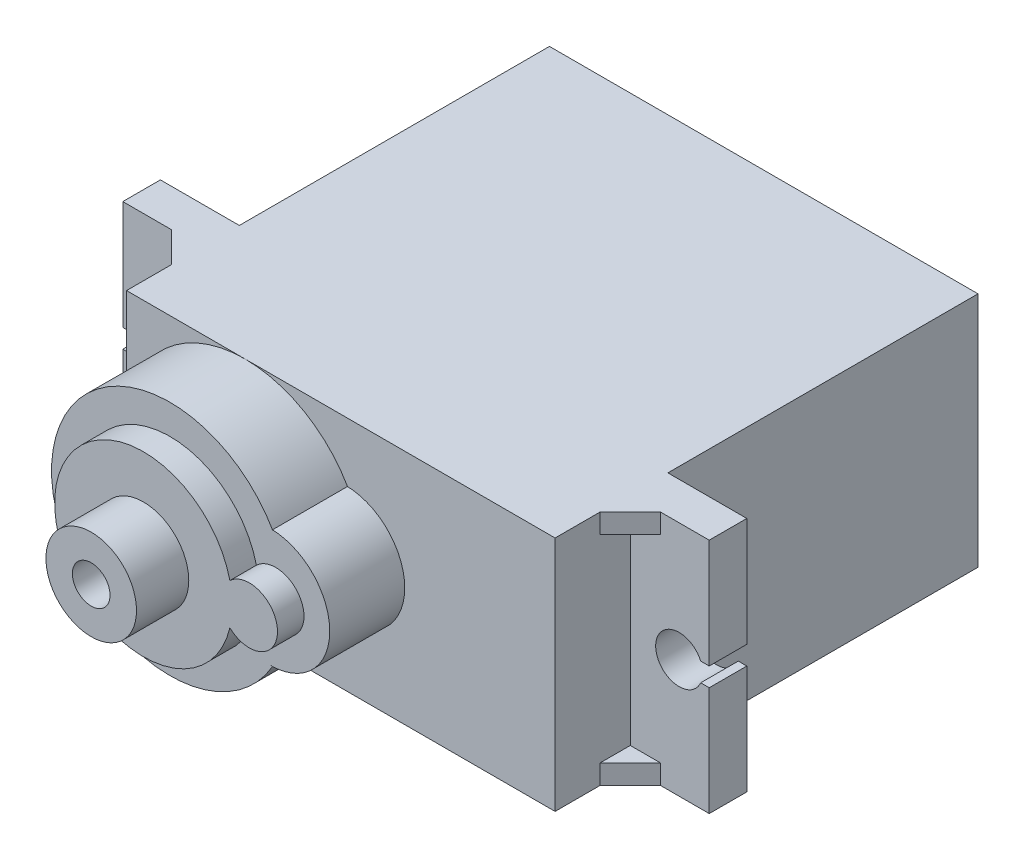
from build123d import *

# Parameters (mm, degrees)
ESQUISSE1_W              = 22.8
ESQUISSE1_H              = 12.6
BOSS_EXTRU_1_DEPTH       = 22.5
ESQUISSE2_W              = 31.2
ESQUISSE2_H              = 12.6
BOSS_EXTRU_2_DEPTH       = 2
ENL_V_MAT_EXTRU_1_DEPTH  = 36.0714984
BOSS_EXTRU_3_DEPTH       = 3.99
BOSS_EXTRUDE6_DEPTH      = 1.41
BOSS_EXTRUDE6_DEPTH_BACK = 4
SKETCH1_R                = 4.725
SKETCH1_R_2              = 1.5
SKETCH3_R                = 2.41
BOSS_EXTRUDE7_DEPTH      = 2.78
SKETCH4_R                = 1
CUT_EXTRUDE1_DEPTH       = 9.78
SKETCH8_W                = 1.6
SKETCH8_H                = 1.04
BOSS_EXTRUDE9_DEPTH      = 1.6
CUT_EXTRUDE3_DEPTH       = 43.472296853
MIRROR3_COPY_1_SKETCH_W  = 22.8
MIRROR3_COPY_1_SKETCH_H  = 12.6
MIRROR3_COPY_1_DEPTH     = 22.5
MIRROR3_COPY_2_SKETCH_W  = 1.6
MIRROR3_COPY_2_SKETCH_H  = 1.04
MIRROR3_COPY_2_DEPTH     = 1.6
MIRROR3_COPY_3_DEPTH     = 43.472296853


with BuildPart() as part:
    # Esquisse1 → Boss.-Extru.1 (new body)
    with BuildSketch(Plane.XY):
        with Locations((-11.4, 6.3)):
            Rectangle(ESQUISSE1_W, ESQUISSE1_H)
    boss_extru_1 = extrude(amount=BOSS_EXTRU_1_DEPTH)

    # Esquisse2 → Boss.-Extru.2 (add)
    with BuildSketch(Plane.XY.offset(18.5)):
        with Locations((-11.4, 6.3)):
            Rectangle(ESQUISSE2_W, ESQUISSE2_H)
    extrude(amount=-BOSS_EXTRU_2_DEPTH)

    # Esquisse3 → Enlèv. mat.-Extru.1 (cut, through all)
    with BuildSketch(Plane.XY.offset(18.5)):
        with BuildLine():
            Line((3.745643924, 6.8), (4.2, 6.8))
            Line((4.2, 6.8), (4.2, 5.8))
            Line((4.2, 5.8), (3.745643924, 5.8))
            ThreePointArc((3.745643924, 5.8), (1.35, 6.3), (3.745643924, 6.8))
        make_face()
        with BuildLine():
            Line((-26.545643924, 5.8), (-27, 5.8))
            Line((-27, 5.8), (-27, 6.8))
            Line((-27, 6.8), (-26.545643924, 6.8))
            ThreePointArc((-26.545643924, 6.8), (-24.15, 6.3), (-26.545643924, 5.8))
        make_face()
    extrude(amount=-ENL_V_MAT_EXTRU_1_DEPTH, mode=Mode.SUBTRACT)

    # Esquisse4 → Boss.-Extru.3 (add)
    with BuildSketch(Plane.XY.offset(22.5)):
        with BuildLine():
            Line((-11.15, 9.45), (-11.044039956, 9.45))
            ThreePointArc((-11.044039956, 9.45), (-22.8, 6.3), (-11.044039956, 3.15))
            Line((-11.044039956, 3.15), (-11.15, 3.15))
            ThreePointArc((-11.15, 3.15), (-8, 6.3), (-11.15, 9.45))
        make_face()
    extrude(amount=BOSS_EXTRU_3_DEPTH)

    # Sketch1 → Boss-Extrude6 (add, two sides: drawn at the far end of the back side and taken through both)
    with BuildSketch(Plane.XY.offset(26.49).offset(-BOSS_EXTRUDE6_DEPTH_BACK)):
        with Locations((-16.5, 6.3)):
            Circle(SKETCH1_R)
        with Locations((-10.87, 6.3)):
            Circle(SKETCH1_R_2)
    extrude(amount=BOSS_EXTRUDE6_DEPTH + BOSS_EXTRUDE6_DEPTH_BACK)

    # Sketch3 → Boss-Extrude7 (add)
    with BuildSketch(Plane.XY.offset(27.9)):
        with Locations((-16.5, 6.3)):
            Circle(SKETCH3_R)
    extrude(amount=BOSS_EXTRUDE7_DEPTH)

    # Sketch4 → Cut-Extrude1 (cut)
    with BuildSketch(Plane.XY.offset(30.68)):
        with Locations((-16.5, 6.3)):
            Circle(SKETCH4_R)
    extrude(amount=-CUT_EXTRUDE1_DEPTH, mode=Mode.SUBTRACT)

    # Sketch8 → Boss-Extrude9 (add)
    with BuildSketch(Plane.XY.offset(18.5)):
        with Locations((0.8, 0.52)):
            Rectangle(SKETCH8_W, SKETCH8_H)
    boss_extrude9 = extrude(amount=BOSS_EXTRUDE9_DEPTH)

    # Sketch9 → Cut-Extrude3 (cut, through all)
    with BuildSketch(Plane(origin=(0, 1.04, 0), x_dir=(1, 0, 0), z_dir=(0, 1, 0))):
        Polygon((1.6, -18.5), (0, -20.1), (1.6, -20.1), align=None)
    cut_extrude3 = extrude(amount=-CUT_EXTRUDE3_DEPTH, mode=Mode.SUBTRACT)

    # Mirror1: Boss.-Extru.1, Boss-Extrude9, Cut-Extrude3 across plane
    add(boss_extru_1.mirror(Plane(origin=(0, 6.3, 0), x_dir=(0, 0, 1), z_dir=(0, -1, 0))))
    add(boss_extrude9.mirror(Plane(origin=(0, 6.3, 0), x_dir=(0, 0, 1), z_dir=(0, -1, 0))))
    add(cut_extrude3.mirror(Plane(origin=(0, 6.3, 0), x_dir=(0, 0, 1), z_dir=(0, -1, 0))), mode=Mode.SUBTRACT)

    # Mirror3: Boss.-Extru.1, Boss-Extrude9, Cut-Extrude3 across plane
    add(boss_extru_1.mirror(Plane(origin=(-11.4, 0, 0), x_dir=(0, 0, 1), z_dir=(1, 0, 0))))
    add(boss_extrude9.mirror(Plane(origin=(-11.4, 0, 0), x_dir=(0, 0, 1), z_dir=(1, 0, 0))))
    add(cut_extrude3.mirror(Plane(origin=(-11.4, 0, 0), x_dir=(0, 0, 1), z_dir=(1, 0, 0))), mode=Mode.SUBTRACT)

    # Mirror3 copy 1 sketch → Mirror3 copy 1 (add)
    with BuildSketch(Plane(origin=(-22.8, 12.6, 0), x_dir=(-1, 0, 0), z_dir=(0, 0, 1))):
        with Locations((-11.4, 6.3)):
            Rectangle(MIRROR3_COPY_1_SKETCH_W, MIRROR3_COPY_1_SKETCH_H)
    extrude(amount=MIRROR3_COPY_1_DEPTH)

    # Mirror3 copy 2 sketch → Mirror3 copy 2 (add)
    with BuildSketch(Plane(origin=(-22.8, 12.6, 18.5), x_dir=(-1, 0, 0), z_dir=(0, 0, 1))):
        with Locations((0.8, 0.52)):
            Rectangle(MIRROR3_COPY_2_SKETCH_W, MIRROR3_COPY_2_SKETCH_H)
    extrude(amount=MIRROR3_COPY_2_DEPTH)

    # Mirror3 copy 3 sketch → Mirror3 copy 3 (cut, through all)
    with BuildSketch(Plane(origin=(-22.8, 11.56, 0), x_dir=(-1, 0, 0), z_dir=(0, -1, 0))):
        Polygon((1.6, -18.5), (0, -20.1), (1.6, -20.1), align=None)
    extrude(amount=-MIRROR3_COPY_3_DEPTH, mode=Mode.SUBTRACT)


solid = part.part
